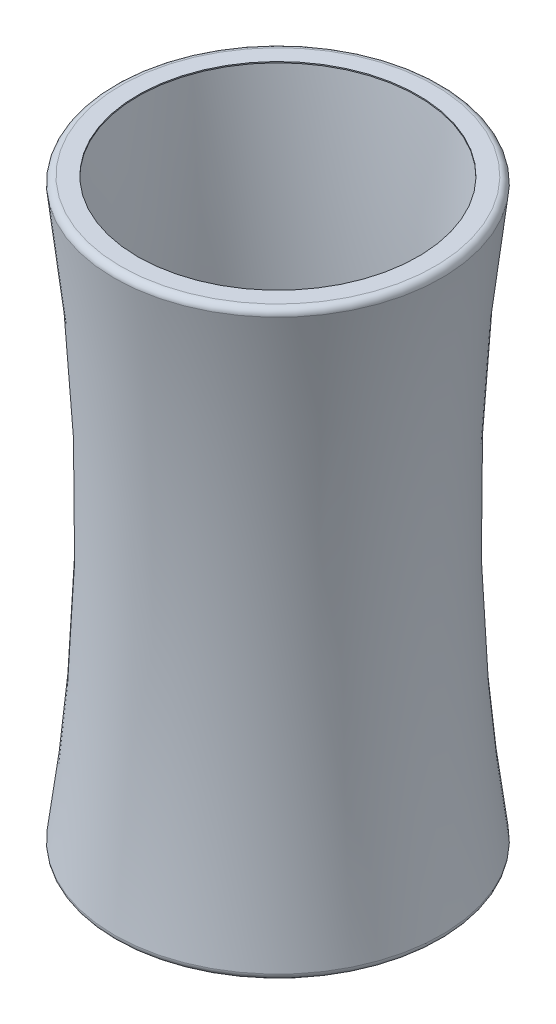
from build123d import *


with BuildPart() as part:
    # Sketch1 → Revolve1 (revolve)
    with BuildSketch(Plane.XY, mode=Mode.PRIVATE) as revolve1_sk:
        with BuildLine():
            Line((12.5, -114.686619696), (12.5, -114.786619696))
            Line((12.5, -114.786619696), (14.004531695, -114.786619696))
            ThreePointArc((14.004531695, -114.786619696), (14.357864572, -114.932974966), (14.504219842, -115.286307843))
            ThreePointArc((14.504219842, -115.286307843), (12.706614743, -140.661619696), (14.504219842, -166.036931549))
            ThreePointArc((14.504219842, -166.036931549), (14.357864572, -166.390264426), (14.004531695, -166.536619696))
            Line((14.004531695, -166.536619696), (11.318941473, -166.536619696))
            Line((11.318941473, -166.536619696), (11.318941473, -166.636619696))
            Line((11.318941473, -166.636619696), (14.004531695, -166.636619696))
            ThreePointArc((14.004531695, -166.636619696), (14.42857525, -166.460975104), (14.604219842, -166.036931549))
            ThreePointArc((14.604219842, -166.036931549), (12.805615521, -140.661619696), (14.604219842, -115.286307843))
            ThreePointArc((14.604219842, -115.286307843), (14.42857525, -114.862264288), (14.004531695, -114.686619696))
            Line((14.004531695, -114.686619696), (12.5, -114.686619696))
        make_face()
    revolve(revolve1_sk.sketch.rotate(Axis((0, 0, 0), (0, -1, 0)), 90), axis=Axis((0, 0, 0), (0, -1, 0)))


solid = part.part
